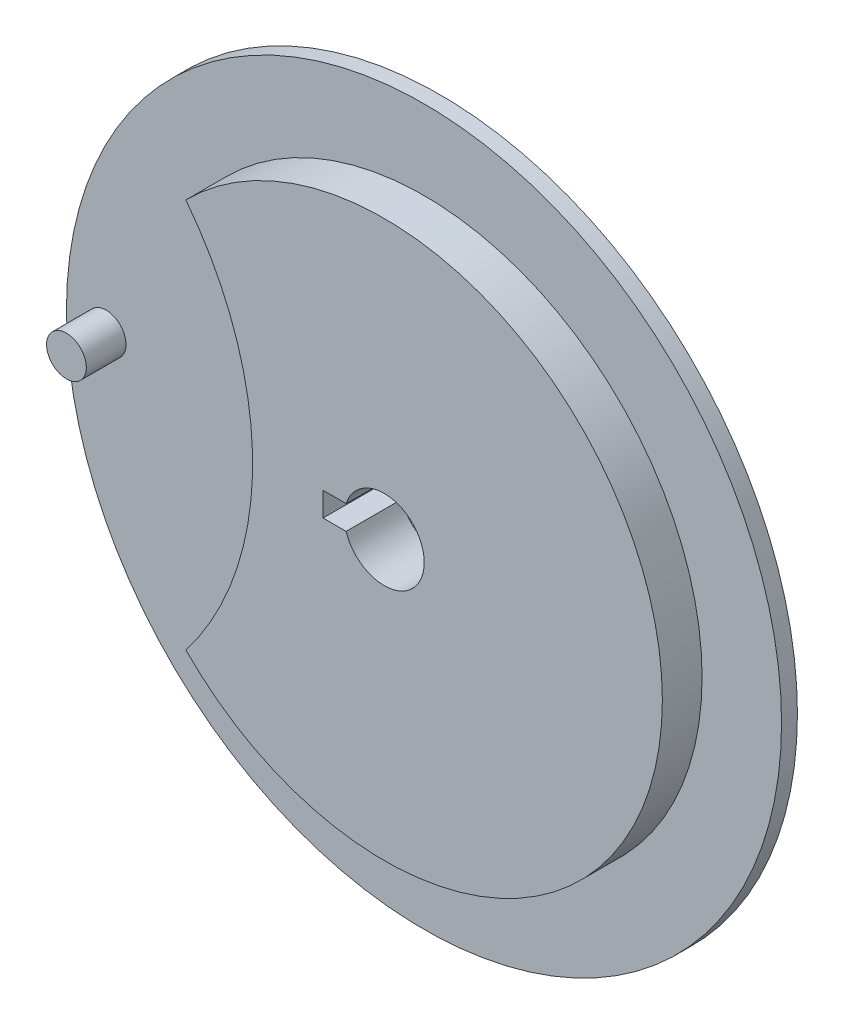
from build123d import *

# Parameters (mm, degrees)
SKETCH_1_R          = 3.5775
SKETCH_1_R_2        = 0.19875
EXTRUDE_2_DEPTH     = 0.159
EXTRUDE_START       = 0.3975
SKETCH_1_6_R        = 0.19875
EXTRUDE_3_DEPTH     = 0.3975
SCALE_2_SCALE       = 25
SKETCH_2_R          = 10
CUT_EXTRUDE_1_DEPTH = 23
SKETCH_3_W          = 10.6
SKETCH_3_H          = 6
CUT_EXTRUDE_2_DEPTH = 40


with BuildPart() as part:
    # 草图1 → 凸台-拉伸2 (new body)
    with BuildSketch(Plane.XY):
        Circle(SKETCH_1_R)
        Circle(SKETCH_1_R_2, mode=Mode.SUBTRACT)
    extrude(amount=-EXTRUDE_2_DEPTH)

    # 草图1<6> → 凸台-拉伸3 (add)
    # profile 1 of 2: a face of its own
    with BuildSketch(Plane.XY.offset(EXTRUDE_START)):
        with BuildLine():
            ThreePointArc((-1.985091803, 1.949799165), (-1.317199128, 0), (-1.985091803, -1.949799165))
            ThreePointArc((-1.985091803, -1.949799165), (2.7825, 0), (-1.985091803, 1.949799165))
        make_face()
        Circle(SKETCH_1_6_R, mode=Mode.SUBTRACT)
    # profile 2 of 2: a face of its own
    with BuildSketch(Plane.XY.offset(EXTRUDE_START)):
        with Locations((-3.18, 0)):
            Circle(SKETCH_1_6_R)
    extrude(amount=-EXTRUDE_3_DEPTH)


with BuildPart() as part_1:
    # 缩放比例2: scaled about (0.208410277, 0, 0.076319073)
    add(part.part.scale(SCALE_2_SCALE).moved(Location((-5.001846648, 0, -1.831657752))))

    # 草图2 → 切除-拉伸1 (cut)
    with BuildSketch(Plane.XY.offset(8.105842259)):
        with Locations((-5.001846653, 0)):
            Circle(SKETCH_2_R)
    extrude(amount=-CUT_EXTRUDE_1_DEPTH, mode=Mode.SUBTRACT)

    # 草图3 → 切除-拉伸2 (cut)
    with BuildSketch(Plane.XY.offset(8.105842259)):
        with Locations((-15.001846653, 0)):
            Rectangle(SKETCH_3_W, SKETCH_3_H)
    extrude(amount=-CUT_EXTRUDE_2_DEPTH, mode=Mode.SUBTRACT)


solid = part_1.part
